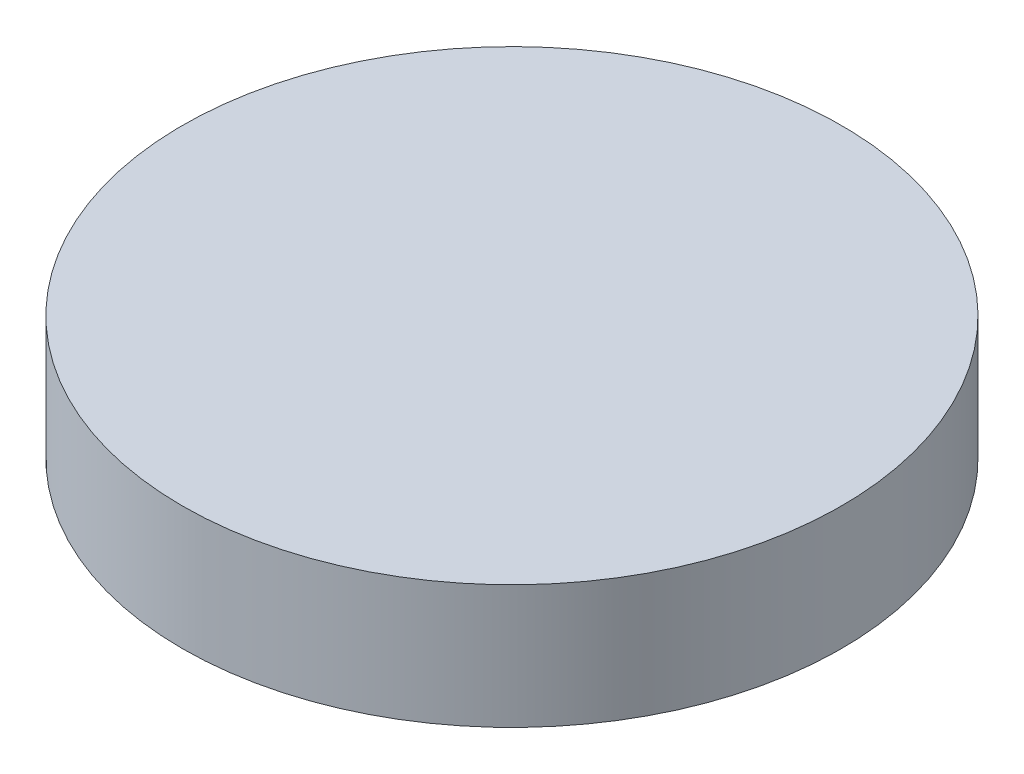
from build123d import *

# Parameters (mm, degrees)
SKETCH1_R           = 4
BOSS_EXTRUDE1_DEPTH = 1.5


with BuildPart() as part:
    # Sketch1 → Boss-Extrude1 (new body)
    with BuildSketch(Plane(origin=(0, 0, 0), x_dir=(1, 0, 0), z_dir=(0, 1, 0))):
        with Locations(Location((0, 0, 0), (0, 0, 270))):
            Circle(SKETCH1_R)
    extrude(amount=BOSS_EXTRUDE1_DEPTH)


solid = part.part
